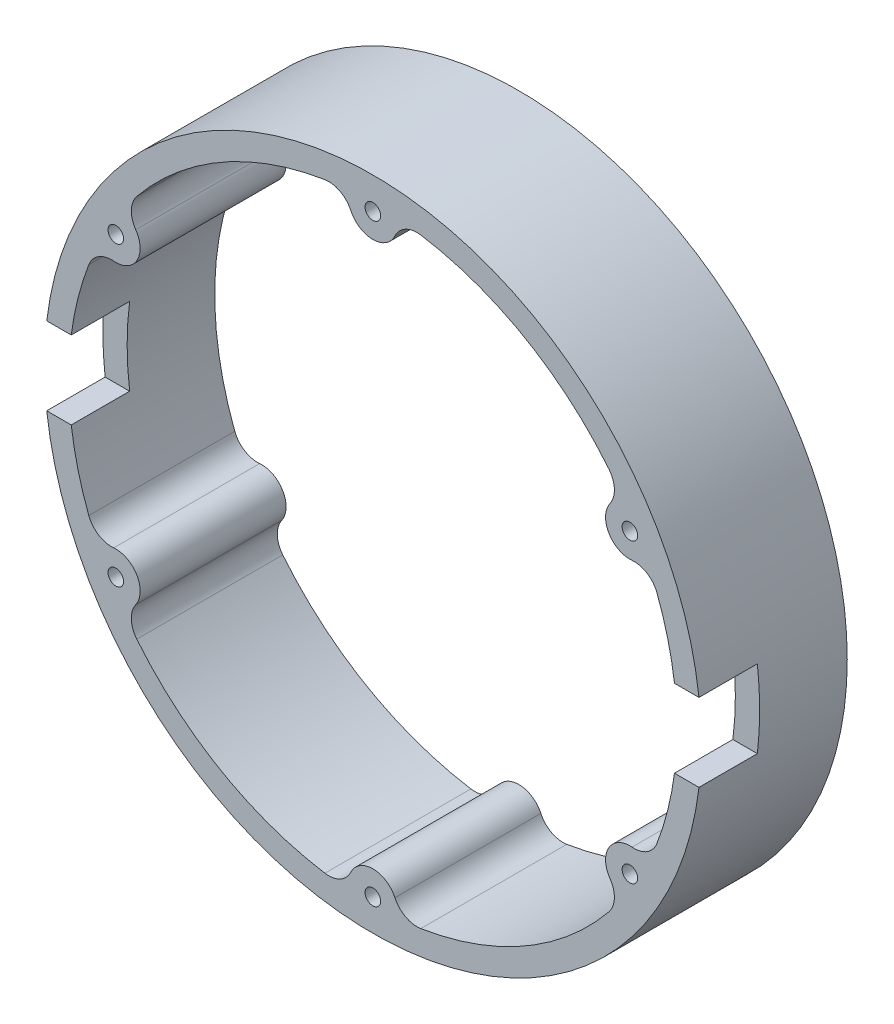
from build123d import *

# Parameters (mm, degrees)
ESQUISSE1_R                  = 67.5
BOSS_EXTRU_1_DEPTH           = 30
ESQUISSE3_R                  = 62.5
ENL_V_MAT_EXTRU_1_DEPTH      = 101.062480481
BOSS_EXTRU_2_DEPTH           = 30
ESQUISSE5_R                  = 1.6
ENL_V_MAT_EXTRU_2_DEPTH      = 120
R_P_TITION_CIRCULAIRE1_COUNT = 6
ENL_V_MAT_EXTRU_3_DEPTH      = 101.062480481
ENL_V_MAT_EXTRU_3_DEPTH_BACK = 101.062480481
ESQUISSE7_W                  = 12
ESQUISSE7_H                  = 16


with BuildPart() as part:
    # Esquisse1 → Boss.-Extru.1 (new body)
    with BuildSketch(Plane.XY):
        Circle(ESQUISSE1_R)
    extrude(amount=BOSS_EXTRU_1_DEPTH)

    # Esquisse3 → Enlèv. mat.-Extru.1 (cut, through all)
    with BuildSketch(Plane(origin=(0, 0, 0), x_dir=(-1, 0, 0), z_dir=(0, 0, -1))):
        Circle(ESQUISSE3_R)
    extrude(amount=-ENL_V_MAT_EXTRU_1_DEPTH, mode=Mode.SUBTRACT)

    # Esquisse4 → Boss.-Extru.2 (add)
    with BuildSketch(Plane(origin=(0, 0, 0), x_dir=(-1, 0, 0), z_dir=(0, 0, -1))):
        with BuildLine():
            ThreePointArc((-9.854675711, 61.718193158), (-6.72003103, 61.196053567), (-4.533150827, 58.890368852))
            ThreePointArc((-4.533150827, 58.890368852), (-2.688107537, 56.784068564), (0, 56))
            ThreePointArc((0, 56), (2.688107537, 56.784068564), (4.533150827, 58.890368852))
            ThreePointArc((4.533150827, 58.890368852), (6.72003103, 61.196053567), (9.854675711, 61.718193158))
            ThreePointArc((9.854675711, 61.718193158), (0, 62.5), (-9.854675711, 61.718193158))
        make_face()
    boss_extru_2 = extrude(amount=-BOSS_EXTRU_2_DEPTH)

    # Esquisse5 → Enlèv. mat.-Extru.2 (cut)
    with BuildSketch(Plane(origin=(0, 0, 0), x_dir=(-1, 0, 0), z_dir=(0, 0, -1))):
        with Locations((0, 61)):
            Circle(ESQUISSE5_R)
    enl_v_mat_extru_2 = extrude(amount=-ENL_V_MAT_EXTRU_2_DEPTH, mode=Mode.SUBTRACT)

    # Répétition circulaire1: Boss.-Extru.2, Enlèv. mat.-Extru.2 ×6 about axis
    r_p_tition_circulaire1_axis = Axis((0, 0, 0), (0, 0, 1))
    add([boss_extru_2.rotate(r_p_tition_circulaire1_axis, i * 360 / R_P_TITION_CIRCULAIRE1_COUNT) for i in range(1, R_P_TITION_CIRCULAIRE1_COUNT)])
    add([enl_v_mat_extru_2.rotate(r_p_tition_circulaire1_axis, i * 360 / R_P_TITION_CIRCULAIRE1_COUNT) for i in range(1, R_P_TITION_CIRCULAIRE1_COUNT)], mode=Mode.SUBTRACT)

    # Esquisse7 → Enlèv. mat.-Extru.3 (cut, two sides: drawn at the far end of the back side and taken through both)
    with BuildSketch(Plane(origin=(0, 0, 0), x_dir=(0, 0, -1), z_dir=(1, 0, 0)).offset(-ENL_V_MAT_EXTRU_3_DEPTH_BACK)):
        with Locations((-24, 0)):
            Rectangle(ESQUISSE7_W, ESQUISSE7_H)
    extrude(amount=ENL_V_MAT_EXTRU_3_DEPTH + ENL_V_MAT_EXTRU_3_DEPTH_BACK, mode=Mode.SUBTRACT)


solid = part.part
